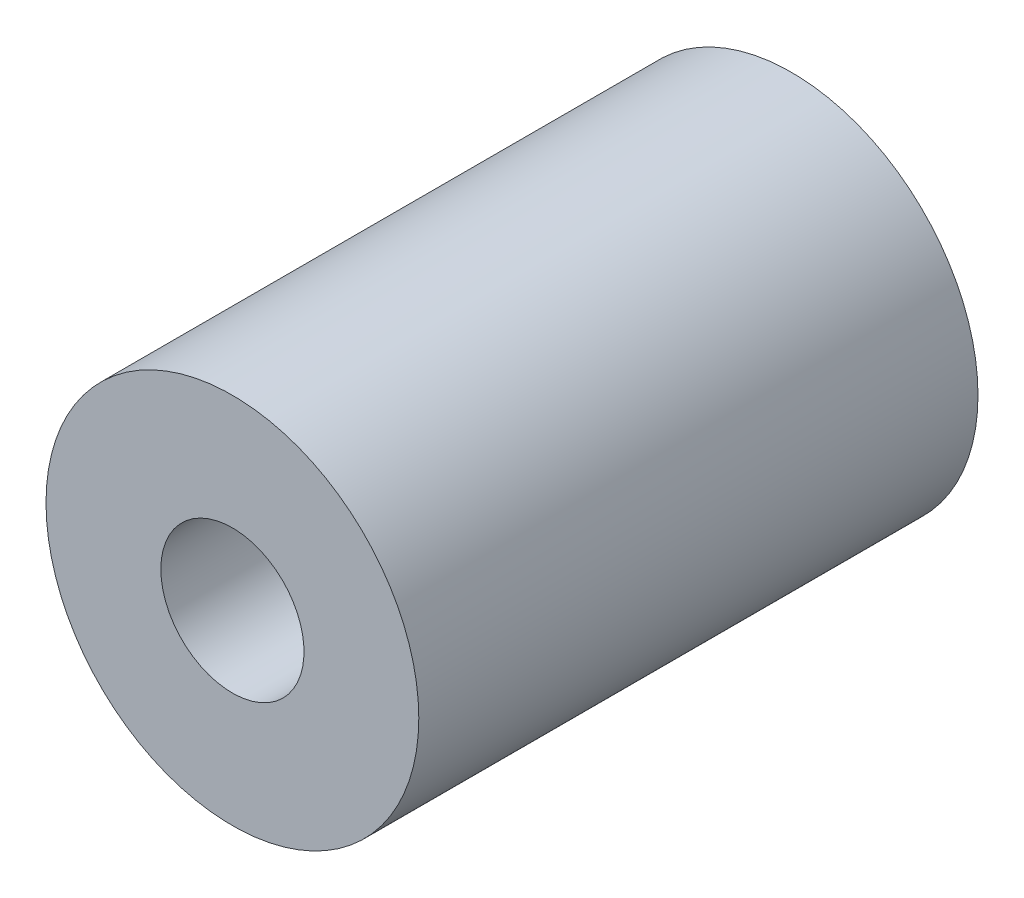
from build123d import *

# Parameters (mm, degrees)
SKETCH1_R      = 6.35
SKETCH1_R_2    = 2.4384
EXTRUDE1_DEPTH = 9.525


with BuildPart() as part:
    # Sketch1 → Extrude1 (new, symmetric)
    with BuildSketch(Plane.XY):
        with Locations(Location((0, 0, 0), (0, 0, 180))):
            Circle(SKETCH1_R)
        with Locations(Location((0, 0, 0), (0, 0, 180))):
            Circle(SKETCH1_R_2, mode=Mode.SUBTRACT)
    extrude(amount=EXTRUDE1_DEPTH, both=True)


solid = part.part
